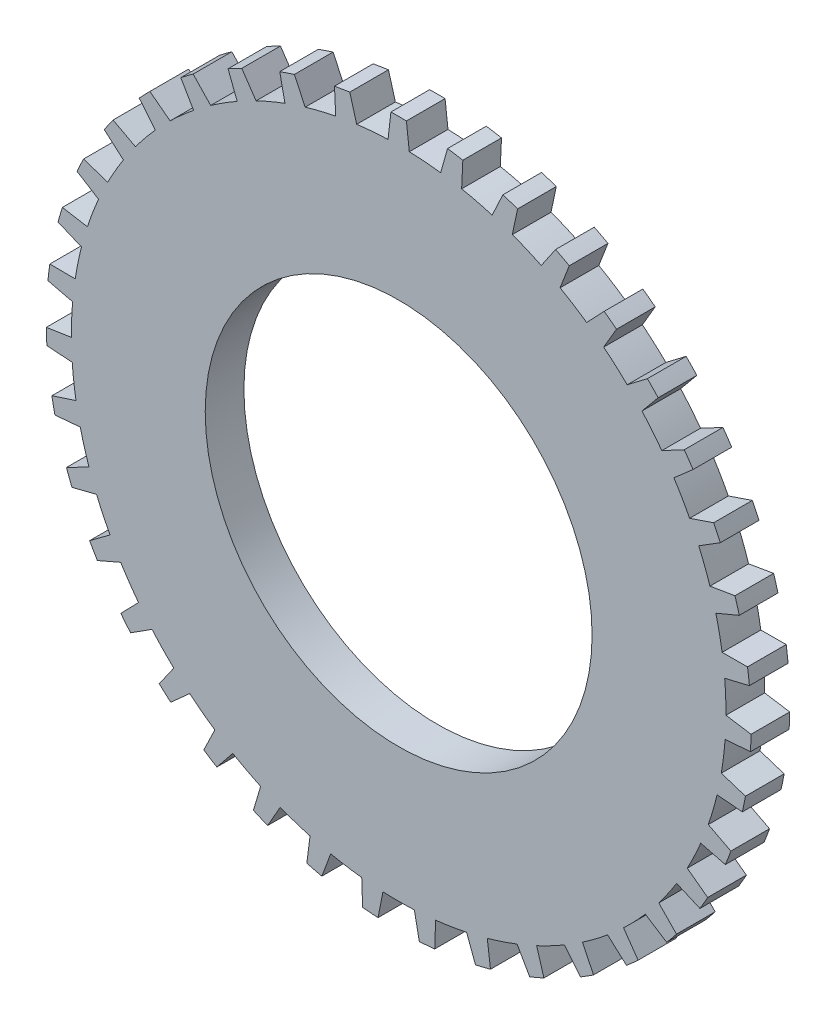
from build123d import *

# Parameters (mm, degrees)
CROQUIS1_R              = 10
SALIENTE_EXTRUIR1_DEPTH = 2


with BuildPart() as part:
    # Croquis1 → Saliente-Extruir1 (new body)
    with BuildSketch(Plane.XY):
        with BuildLine():
            Line((-0.4, 18.214883973), (-0.55, 16.910333585))
            ThreePointArc((-0.55, 16.910333585), (-1.361436041, 16.86441146), (-2.169730626, 16.779575411))
            Line((-2.169730626, 16.779575411), (-2.527052764, 18.043170522))
            Line((-2.527052764, 18.043170522), (-3.316692974, 17.914841497))
            Line((-3.316692974, 17.914841497), (-3.255485915, 16.603123002))
            ThreePointArc((-3.255485915, 16.603123002), (-4.049047645, 16.427632061), (-4.833266368, 16.214235048))
            Line((-4.833266368, 16.214235048), (-5.388656188, 17.404148432))
            Line((-5.388656188, 17.404148432), (-6.147485342, 17.150814037))
            Line((-6.147485342, 17.150814037), (-5.876656454, 15.865900255))
            ThreePointArc((-5.876656454, 15.865900255), (-6.631791042, 15.565385622), (-7.37162305, 15.228954514))
            Line((-7.37162305, 15.228954514), (-8.110696248, 16.314368039))
            Line((-8.110696248, 16.314368039), (-8.819061069, 15.942589502))
            Line((-8.819061069, 15.942589502), (-8.345624678, 14.717759024))
            ThreePointArc((-8.345624678, 14.717759024), (-9.042774534, 14.30000387), (-9.719058567, 13.849252057))
            Line((-9.719058567, 13.849252057), (-10.622673536, 14.802054084))
            ThreePointArc((-10.622673536, 14.802054084), (-10.94508879, 14.565267918), (-11.262227746, 14.321460273))
            Line((-11.262227746, 14.321460273), (-10.598445607, 13.188435566))
            ThreePointArc((-10.598445607, 13.188435566), (-11.219554916, 12.66425953), (-11.814775573, 12.110861247))
            Line((-11.814775573, 12.110861247), (-12.859529158, 12.906374704))
            ThreePointArc((-12.859529158, 12.906374704), (-13.139786048, 12.620935812), (-13.413708641, 12.329412746))
            Line((-13.413708641, 12.329412746), (-12.576772362, 11.317538555))
            ThreePointArc((-12.576772362, 11.317538555), (-13.105754719, 10.700517521), (-13.604496097, 10.058805492))
            Line((-13.604496097, 10.058805492), (-14.76332973, 10.676426997))
            ThreePointArc((-14.76332973, 10.676426997), (-14.994169749, 10.349728098), (-15.217781528, 10.018039905))
            Line((-15.217781528, 10.018039905), (-14.229367318, 9.153523239))
            ThreePointArc((-14.229367318, 9.153523239), (-14.652522359, 8.459637728), (-15.041867318, 7.746231958))
            Line((-15.041867318, 7.746231958), (-16.284767817, 8.16996544))
            ThreePointArc((-16.284767817, 8.16996544), (-16.460212329, 7.810467862), (-16.627721867, 7.447205092))
            Line((-16.627721867, 7.447205092), (-15.513429136, 6.75243648))
            ThreePointArc((-15.513429136, 6.75243648), (-15.819797366, 5.999657762), (-16.089662077, 5.233035086))
            Line((-16.089662077, 5.233035086), (-17.384438972, 5.451906069))
            ThreePointArc((-17.384438972, 5.451906069), (-17.499944057, 5.068920612), (-17.607012943, 4.68349158))
            Line((-17.607012943, 4.68349158), (-16.395701288, 4.176465163))
            ThreePointArc((-16.395701288, 4.176465163), (-16.577347932, 3.384289811), (-16.72074304, 2.584305353))
            Line((-16.72074304, 2.584305353), (-18.033862289, 2.592645195))
            ThreePointArc((-18.033862289, 2.592645195), (-18.086436425, 2.19609098), (-18.130291633, 1.798478096))
            Line((-18.130291633, 1.798478096), (-16.853333388, 1.492325592))
            ThreePointArc((-16.853333388, 1.492325592), (-16.905553893, 0.681270532), (-16.918765541, -0.13135653))
            Line((-16.918765541, -0.13135653), (-18.216218045, -0.333763828))
            ThreePointArc((-18.216218045, -0.333763828), (-18.204499591, -0.733616254), (-18.184005293, -1.133115026))
            Line((-18.184005293, -1.133115026), (-16.874473007, -1.230464428))
            ThreePointArc((-16.874473007, -1.230464428), (-16.795914889, -2.039393296), (-16.678600901, -2.843616349))
            Line((-16.678600901, -2.843616349), (-17.926783322, -3.251528543))
            ThreePointArc((-17.926783322, -3.251528543), (-17.851075779, -3.644323213), (-17.766762767, -4.035361065))
            Line((-17.766762767, -4.035361065), (-16.458572638, -3.921386066))
            ThreePointArc((-16.458572638, -3.921386066), (-16.251270512, -4.707237909), (-16.006469259, -5.482227997))
            Line((-16.006469259, -5.482227997), (-17.173054328, -6.085080377))
            ThreePointArc((-17.173054328, -6.085080377), (-17.035318482, -6.460644115), (-16.889370419, -6.833093371))
            Line((-16.889370419, -6.833093371), (-15.616403884, -6.510745864))
            ThreePointArc((-15.616403884, -6.510745864), (-15.285726764, -7.253167532), (-14.919778471, -7.978852821))
            Line((-14.919778471, -7.978852821), (-15.974552248, -8.761031825))
            ThreePointArc((-15.974552248, -8.761031825), (-15.778355384, -9.109637728), (-15.574552248, -9.453852148))
            Line((-15.574552248, -9.453852148), (-14.369778471, -8.931480765))
            ThreePointArc((-14.369778471, -8.931480765), (-13.924290723, -9.611243927), (-13.446673258, -10.268829547))
            Line((-13.446673258, -10.268829547), (-14.362317655, -11.210077151))
            ThreePointArc((-14.362317655, -11.210077151), (-14.112741169, -11.522696509), (-13.856361355, -11.829761121))
            Line((-13.856361355, -11.829761121), (-12.750983345, -11.120895005))
            ThreePointArc((-12.750983345, -11.120895005), (-12.202222866, -11.720394152), (-11.62530627, -12.292848982))
            Line((-11.62530627, -12.292848982), (-12.378106579, -13.368787367))
            ThreePointArc((-12.378106579, -13.368787367), (-12.081614372, -13.637323503), (-11.779297981, -13.899285494))
            Line((-11.779297981, -13.899285494), (-10.801944447, -13.022283906))
            ThreePointArc((-10.801944447, -13.022283906), (-10.164123847, -13.525992326), (-9.502849957, -13.998490085))
            Line((-9.502849957, -13.998490085), (-10.073309045, -15.181253013))
            ThreePointArc((-10.073309045, -15.181253013), (-9.737580108, -15.398750982), (-9.397156976, -15.608825674))
            Line((-9.397156976, -15.608825674), (-8.573140863, -14.586402494))
            ThreePointArc((-8.573140863, -14.586402494), (-7.862779359, -14.981274403), (-7.134274821, -15.341577649))
            Line((-7.134274821, -15.341577649), (-7.507618097, -16.60053218))
            ThreePointArc((-7.507618097, -16.60053218), (-7.141347635, -16.761358898), (-6.771634543, -16.914105468))
            Line((-6.771634543, -16.914105468), (-6.122297433, -15.772740919))
            ThreePointArc((-6.122297433, -15.772740919), (-5.357793015, -16.048549342), (-4.580925715, -16.287326409))
            Line((-4.580925715, -16.287326409), (-4.747483785, -17.589866283))
            ThreePointArc((-4.747483785, -17.589866283), (-4.360158009, -17.689856424), (-3.970730331, -17.781318815))
            Line((-3.970730331, -17.781318815), (-3.512889716, -16.55057364))
            ThreePointArc((-3.512889716, -16.55057364), (-2.714042647, -16.700175283), (-1.908933039, -16.811241971))
            Line((-1.908933039, -16.811241971), (-1.864392136, -18.12363209))
            ThreePointArc((-1.864392136, -18.12363209), (-1.46604258, -18.16019596), (-1.06698629, -18.188005345))
            Line((-1.06698629, -18.188005345), (-0.8125, -16.899755197))
            ThreePointArc((-0.8125, -16.899755197), (0, -16.919275456), (0.8125, -16.899755197))
            Line((0.8125, -16.899755197), (1.06698629, -18.188005345))
            ThreePointArc((1.06698629, -18.188005345), (1.46604258, -18.16019596), (1.864392136, -18.12363209))
            Line((1.864392136, -18.12363209), (1.908933039, -16.811241971))
            ThreePointArc((1.908933039, -16.811241971), (2.714042647, -16.700175283), (3.512889716, -16.55057364))
            Line((3.512889716, -16.55057364), (3.970730331, -17.781318815))
            ThreePointArc((3.970730331, -17.781318815), (4.360158009, -17.689856424), (4.747483785, -17.589866283))
            Line((4.747483785, -17.589866283), (4.580925715, -16.287326409))
            ThreePointArc((4.580925715, -16.287326409), (5.357793015, -16.048549342), (6.122297433, -15.772740919))
            Line((6.122297433, -15.772740919), (6.771634543, -16.914105468))
            ThreePointArc((6.771634543, -16.914105468), (7.141347635, -16.761358898), (7.507618097, -16.60053218))
            Line((7.507618097, -16.60053218), (7.134274821, -15.341577649))
            ThreePointArc((7.134274821, -15.341577649), (7.862779359, -14.981274403), (8.573140863, -14.586402494))
            Line((8.573140863, -14.586402494), (9.397156976, -15.608825674))
            ThreePointArc((9.397156976, -15.608825674), (9.737580108, -15.398750982), (10.073309045, -15.181253013))
            Line((10.073309045, -15.181253013), (9.502849957, -13.998490085))
            ThreePointArc((9.502849957, -13.998490085), (10.164123847, -13.525992326), (10.801944447, -13.022283906))
            Line((10.801944447, -13.022283906), (11.779297981, -13.899285494))
            ThreePointArc((11.779297981, -13.899285494), (12.081614372, -13.637323503), (12.378106579, -13.368787367))
            Line((12.378106579, -13.368787367), (11.62530627, -12.292848982))
            ThreePointArc((11.62530627, -12.292848982), (12.202222866, -11.720394152), (12.750983345, -11.120895005))
            Line((12.750983345, -11.120895005), (13.856361355, -11.829761121))
            ThreePointArc((13.856361355, -11.829761121), (14.112741169, -11.522696509), (14.362317655, -11.210077151))
            Line((14.362317655, -11.210077151), (13.446673258, -10.268829547))
            ThreePointArc((13.446673258, -10.268829547), (13.924290723, -9.611243927), (14.369778471, -8.931480765))
            Line((14.369778471, -8.931480765), (15.574552248, -9.453852148))
            ThreePointArc((15.574552248, -9.453852148), (15.778355384, -9.109637728), (15.974552248, -8.761031825))
            Line((15.974552248, -8.761031825), (14.919778471, -7.978852821))
            ThreePointArc((14.919778471, -7.978852821), (15.285726764, -7.253167532), (15.616403884, -6.510745864))
            Line((15.616403884, -6.510745864), (16.889370419, -6.833093371))
            ThreePointArc((16.889370419, -6.833093371), (17.035318482, -6.460644115), (17.173054328, -6.085080377))
            Line((17.173054328, -6.085080377), (16.006469259, -5.482227997))
            ThreePointArc((16.006469259, -5.482227997), (16.251270512, -4.707237909), (16.458572638, -3.921386066))
            Line((16.458572638, -3.921386066), (17.766762767, -4.035361065))
            ThreePointArc((17.766762767, -4.035361065), (17.851075779, -3.644323213), (17.926783322, -3.251528543))
            Line((17.926783322, -3.251528543), (16.678600901, -2.843616349))
            ThreePointArc((16.678600901, -2.843616349), (16.795914889, -2.039393296), (16.874473007, -1.230464428))
            Line((16.874473007, -1.230464428), (18.184005293, -1.133115026))
            ThreePointArc((18.184005293, -1.133115026), (18.204499591, -0.733616254), (18.216218045, -0.333763828))
            Line((18.216218045, -0.333763828), (16.918765541, -0.13135653))
            ThreePointArc((16.918765541, -0.13135653), (16.905553893, 0.681270532), (16.853333388, 1.492325592))
            Line((16.853333388, 1.492325592), (18.130291633, 1.798478096))
            ThreePointArc((18.130291633, 1.798478096), (18.086436425, 2.19609098), (18.033862289, 2.592645195))
            Line((18.033862289, 2.592645195), (16.72074304, 2.584305353))
            ThreePointArc((16.72074304, 2.584305353), (16.577347932, 3.384289811), (16.395701288, 4.176465163))
            Line((16.395701288, 4.176465163), (17.607012943, 4.68349158))
            ThreePointArc((17.607012943, 4.68349158), (17.499944057, 5.068920612), (17.384438972, 5.451906069))
            Line((17.384438972, 5.451906069), (16.089662077, 5.233035086))
            ThreePointArc((16.089662077, 5.233035086), (15.819797366, 5.999657762), (15.513429136, 6.75243648))
            Line((15.513429136, 6.75243648), (16.627721867, 7.447205092))
            ThreePointArc((16.627721867, 7.447205092), (16.460212329, 7.810467862), (16.284767817, 8.16996544))
            Line((16.284767817, 8.16996544), (15.041867318, 7.746231958))
            ThreePointArc((15.041867318, 7.746231958), (14.652522359, 8.459637728), (14.229367318, 9.153523239))
            Line((14.229367318, 9.153523239), (15.217781528, 10.018039905))
            ThreePointArc((15.217781528, 10.018039905), (14.994169749, 10.349728098), (14.76332973, 10.676426997))
            Line((14.76332973, 10.676426997), (13.604496097, 10.058805492))
            ThreePointArc((13.604496097, 10.058805492), (13.105754719, 10.700517521), (12.576772362, 11.317538555))
            Line((12.576772362, 11.317538555), (13.413708641, 12.329412746))
            ThreePointArc((13.413708641, 12.329412746), (13.139786048, 12.620935812), (12.859529158, 12.906374704))
            Line((12.859529158, 12.906374704), (11.814775573, 12.110861247))
            ThreePointArc((11.814775573, 12.110861247), (11.219554916, 12.66425953), (10.598445607, 13.188435566))
            Line((10.598445607, 13.188435566), (11.262227746, 14.321460273))
            ThreePointArc((11.262227746, 14.321460273), (10.94508879, 14.565267918), (10.622673536, 14.802054084))
            Line((10.622673536, 14.802054084), (9.719058567, 13.849252057))
            ThreePointArc((9.719058567, 13.849252057), (9.042774534, 14.30000387), (8.345624678, 14.717759024))
            Line((8.345624678, 14.717759024), (8.819061069, 15.942589502))
            ThreePointArc((8.819061069, 15.942589502), (8.466919482, 16.132367236), (8.110696248, 16.314368039))
            Line((8.110696248, 16.314368039), (7.37162305, 15.228954514))
            ThreePointArc((7.37162305, 15.228954514), (6.631791042, 15.565385622), (5.876656454, 15.865900255))
            Line((5.876656454, 15.865900255), (6.147485342, 17.150814037))
            ThreePointArc((6.147485342, 17.150814037), (5.769461407, 17.281646716), (5.388656188, 17.404148432))
            Line((5.388656188, 17.404148432), (4.833266368, 16.214235048))
            ThreePointArc((4.833266368, 16.214235048), (4.049047645, 16.427632061), (3.255485915, 16.603123002))
            Line((3.255485915, 16.603123002), (3.316692974, 17.914841497))
            ThreePointArc((3.316692974, 17.914841497), (2.922577312, 17.983340624), (2.527052764, 18.043170522))
            Line((2.527052764, 18.043170522), (2.169730626, 16.779575411))
            ThreePointArc((2.169730626, 16.779575411), (1.361436041, 16.86441146), (0.55, 16.910333585))
            Line((0.55, 16.910333585), (0.4, 18.214883973))
            ThreePointArc((0.4, 18.214883973), (0, 18.219275456), (-0.4, 18.214883973))
        make_face()
        Circle(CROQUIS1_R, mode=Mode.SUBTRACT)
    extrude(amount=SALIENTE_EXTRUIR1_DEPTH)


solid = part.part
